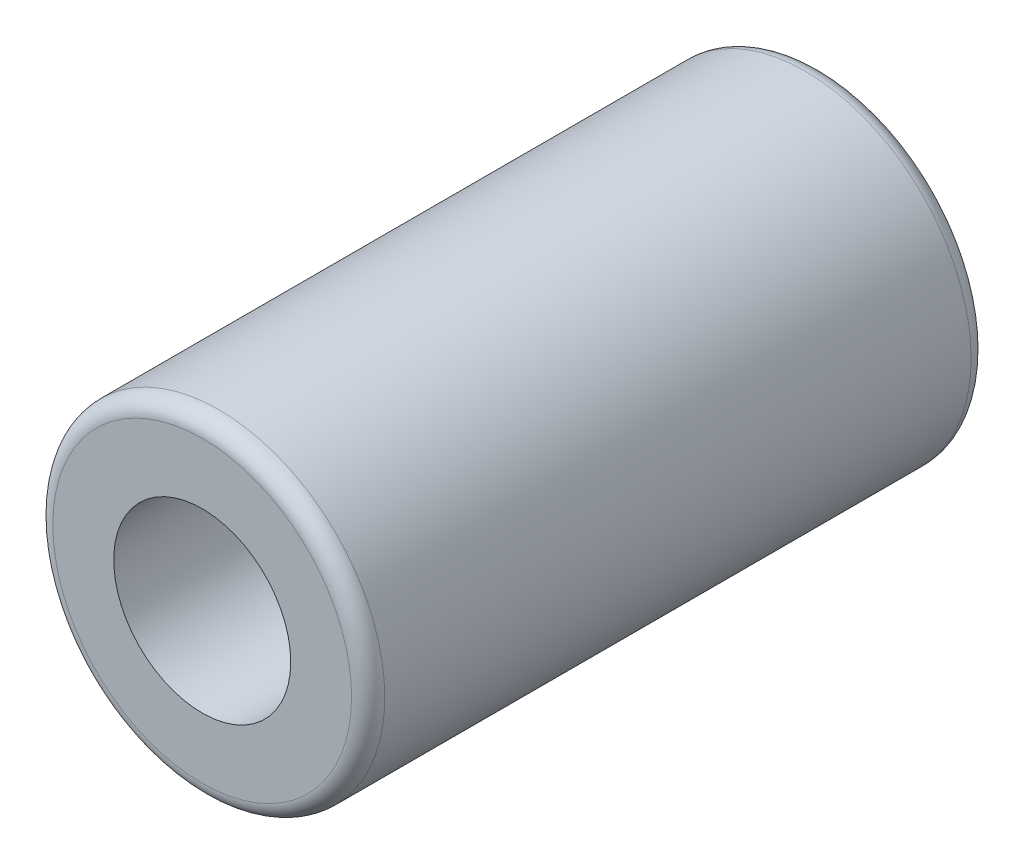
from build123d import *

# Parameters (mm, degrees)
SKETCH1_R           = 3
SKETCH1_R_2         = 1.6
BOSS_EXTRUDE1_DEPTH = 11.2
FILLET1_R           = 0.3


with BuildPart() as part:
    # Sketch1 → Boss-Extrude1 (new body)
    with BuildSketch(Plane.XY):
        Circle(SKETCH1_R)
        Circle(SKETCH1_R_2, mode=Mode.SUBTRACT)
    extrude(amount=BOSS_EXTRUDE1_DEPTH)

    # Fillet1
    fillet1_edges = [part.edges().sort_by_distance(p)[0] for p in [
        (-3, 0, 0),
        (-3, 0, 11.2),
    ]]
    fillet(fillet1_edges, radius=FILLET1_R)


solid = part.part
